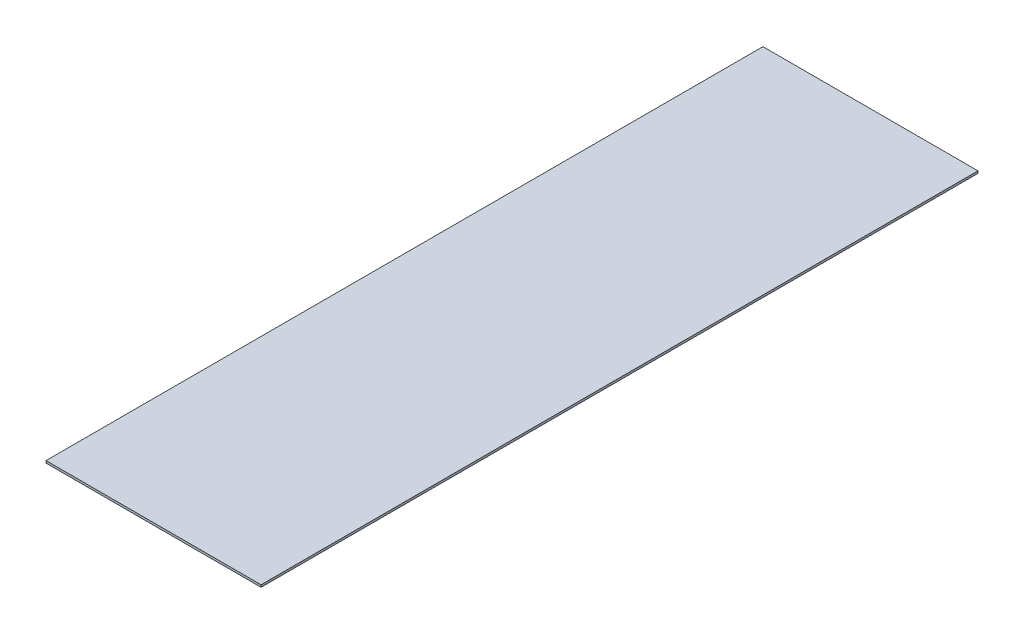
from build123d import *

# Parameters (mm, degrees)
CROQUIS1_W              = 914.4
CROQUIS1_H              = 3048
SALIENTE_EXTRUIR1_DEPTH = 9.5


with BuildPart() as part:
    # Croquis1 → Saliente-Extruir1 (new body)
    with BuildSketch(Plane(origin=(0, 0, 0), x_dir=(1, 0, 0), z_dir=(0, 1, 0))):
        Rectangle(CROQUIS1_W, CROQUIS1_H)
    extrude(amount=SALIENTE_EXTRUIR1_DEPTH)


solid = part.part
